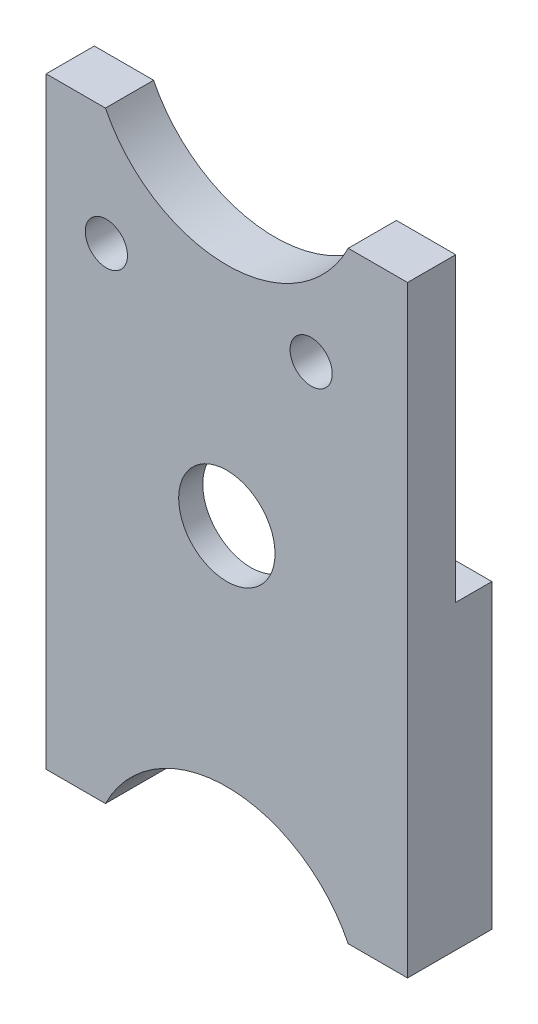
from build123d import *

# Parameters (mm, degrees)
SKETCH_1_R          = 4
EXTRUDE_1_DEPTH     = 7
SKETCH_3_R          = 1.75
CUT_EXTRUDE_2_DEPTH = 10
CUT_EXTRUDE_4_DEPTH = 3
SKETCH_6_R          = 11.25
CUT_EXTRUDE_5_DEPTH = 5


with BuildPart() as part:
    # Эскиз1 → Бобышка-Вытянуть1 (new body)
    with BuildSketch(Plane.XY):
        with BuildLine():
            Line((-15, -25), (-10.077822185, -25))
            ThreePointArc((-10.077822185, -25), (0, -18.75), (10.077822185, -25))
            Line((10.077822185, -25), (15, -25))
            Line((15, -25), (15, 25))
            Line((15, 25), (10.077822185, 25))
            ThreePointArc((10.077822185, 25), (0, 18.75), (-10.077822185, 25))
            Line((-10.077822185, 25), (-15, 25))
            Line((-15, 25), (-15, -25))
        make_face()
        Circle(SKETCH_1_R, mode=Mode.SUBTRACT)
    extrude(amount=EXTRUDE_1_DEPTH)

    # Эскиз3 → Вырез-Вытянуть2 (cut)
    with BuildSketch(Plane.XY.offset(7)):
        with Locations((-10, 15.3)):
            Circle(SKETCH_3_R)
        with Locations((7, 15.3)):
            Circle(SKETCH_3_R)
    extrude(amount=-CUT_EXTRUDE_2_DEPTH, mode=Mode.SUBTRACT)

    # Эскиз4 → Вырез-Вытянуть4 (cut)
    with BuildSketch(Plane(origin=(0, 0, 0), x_dir=(-1, 0, 0), z_dir=(0, 0, -1))):
        with BuildLine():
            Line((-15, 0), (-4, 0))
            ThreePointArc((-4, 0), (0, 4), (4, 0))
            Line((4, 0), (15, 0))
            Line((15, 0), (15, 25))
            Line((15, 25), (-15, 25))
            Line((-15, 25), (-15, 0))
        make_face()
    extrude(amount=-CUT_EXTRUDE_4_DEPTH, mode=Mode.SUBTRACT)

    # Эскиз6 → Вырез-Вытянуть5 (cut)
    with BuildSketch(Plane(origin=(0, 0, 0), x_dir=(-1, 0, 0), z_dir=(0, 0, -1))):
        Circle(SKETCH_6_R)
    extrude(amount=-CUT_EXTRUDE_5_DEPTH, mode=Mode.SUBTRACT)


solid = part.part
